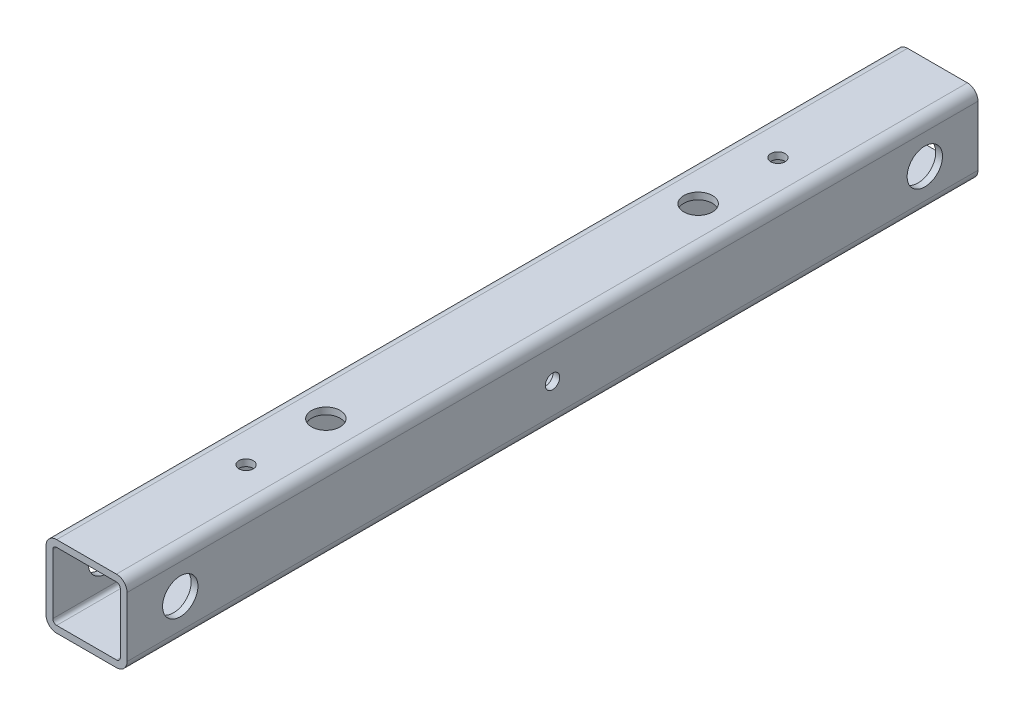
from build123d import *

# Parameters (mm, degrees)
BOSS_EXTRUDE1_DEPTH             = 400
CUT_EXTRUDE1_DEPTH              = 401.906229685
CUT_EXTRUDE1_DEPTH_BACK         = 401.906229685
SKETCH2_R                       = 8.3125
CUT_EXTRUDE2_DEPTH              = 401.906229685
CUT_EXTRUDE2_DEPTH_BACK         = 401.906229685
SKETCH3_R                       = 3.38
CUT_EXTRUDE3_DEPTH              = 401.906229685
CUT_EXTRUDE3_DEPTH_BACK         = 401.906229685
SKETCH4_R                       = 3.38
BROOM_MOUNTING_HOLES_DEPTH      = 401.906229685
BROOM_MOUNTING_HOLES_DEPTH_BACK = 401.906229685
SKETCH6_R                       = 6.725


with BuildPart() as part:
    # Sketch1 → Boss-Extrude1 (new body)
    with BuildSketch(Plane.XY):
        with BuildLine():
            Line((-14.05, 19.05), (14.05, 19.05))
            ThreePointArc((14.05, 19.05), (17.585533906, 17.585533906), (19.05, 14.05))
            Line((19.05, 14.05), (19.05, -14.05))
            ThreePointArc((19.05, -14.05), (17.585533906, -17.585533906), (14.05, -19.05))
            Line((14.05, -19.05), (-14.05, -19.05))
            ThreePointArc((-14.05, -19.05), (-17.585533906, -17.585533906), (-19.05, -14.05))
            Line((-19.05, -14.05), (-19.05, 14.05))
            ThreePointArc((-19.05, 14.05), (-17.585533906, 17.585533906), (-14.05, 19.05))
        make_face()
        with BuildLine():
            Line((-15.875, 14.05), (-15.875, -14.05))
            ThreePointArc((-15.875, -14.05), (-15.340469876, -15.340469876), (-14.05, -15.875))
            Line((-14.05, -15.875), (14.05, -15.875))
            ThreePointArc((14.05, -15.875), (15.340469876, -15.340469876), (15.875, -14.05))
            Line((15.875, -14.05), (15.875, 14.05))
            ThreePointArc((15.875, 14.05), (15.340469876, 15.340469876), (14.05, 15.875))
            Line((14.05, 15.875), (-14.05, 15.875))
            ThreePointArc((-14.05, 15.875), (-15.340469876, 15.340469876), (-15.875, 14.05))
        make_face(mode=Mode.SUBTRACT)
    extrude(amount=BOSS_EXTRUDE1_DEPTH)

    # Sketch2 → Cut-Extrude1 (cut, two sides: drawn at the far end of the back side and taken through both)
    with BuildSketch(Plane(origin=(0, 0, 0), x_dir=(0, 0, -1), z_dir=(1, 0, 0)).offset(-CUT_EXTRUDE1_DEPTH_BACK)):
        with Locations((-375, 0)):
            Circle(SKETCH2_R)
        with Locations((-25, 0)):
            Circle(SKETCH2_R)
    extrude(amount=CUT_EXTRUDE1_DEPTH + CUT_EXTRUDE1_DEPTH_BACK, mode=Mode.SUBTRACT)

    # Sketch3 → Cut-Extrude2 (cut, two sides: drawn at the far end of the back side and taken through both)
    with BuildSketch(Plane(origin=(0, 0, 0), x_dir=(1, 0, 0), z_dir=(0, 1, 0)).offset(-CUT_EXTRUDE2_DEPTH_BACK)):
        with Locations(Location((0, -325, 0), (0, 0, 90))):
            Circle(SKETCH3_R)
        with Locations(Location((0, -75, 0), (0, 0, 90))):
            Circle(SKETCH3_R)
    extrude(amount=CUT_EXTRUDE2_DEPTH + CUT_EXTRUDE2_DEPTH_BACK, mode=Mode.SUBTRACT)

    # Sketch4 → Cut-Extrude3 (cut, two sides: drawn at the far end of the back side and taken through both)
    with BuildSketch(Plane(origin=(0, 0, 0), x_dir=(0, 0, -1), z_dir=(1, 0, 0)).offset(-CUT_EXTRUDE3_DEPTH_BACK)):
        with Locations((-200, 0)):
            Circle(SKETCH4_R)
    extrude(amount=CUT_EXTRUDE3_DEPTH + CUT_EXTRUDE3_DEPTH_BACK, mode=Mode.SUBTRACT)

    # Sketch6 → Broom Mounting Holes (cut, two sides: drawn at the far end of the back side and taken through both)
    with BuildSketch(Plane(origin=(0, 0, 0), x_dir=(1, 0, 0), z_dir=(0, 1, 0)).offset(-BROOM_MOUNTING_HOLES_DEPTH_BACK)):
        with Locations(Location((0, -112.5, 0), (0, 0, 270))):
            Circle(SKETCH6_R)
        with Locations(Location((0, -287.5, 0), (0, 0, 270))):
            Circle(SKETCH6_R)
    extrude(amount=BROOM_MOUNTING_HOLES_DEPTH + BROOM_MOUNTING_HOLES_DEPTH_BACK, mode=Mode.SUBTRACT)


solid = part.part
